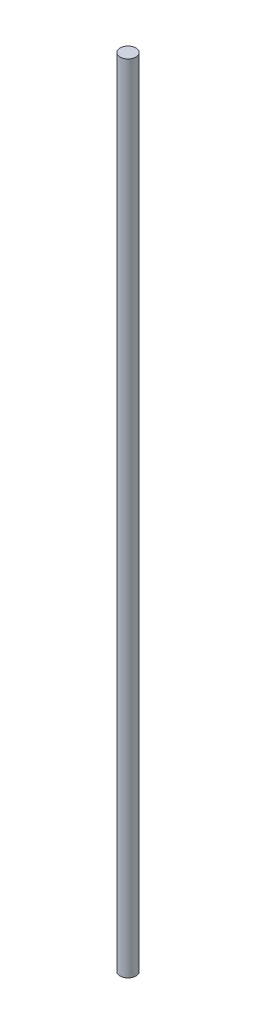
from build123d import *

# Parameters (mm, degrees)
CROQUIS1_R              = 2.5
SALIENTE_EXTRUIR1_DEPTH = 250


with BuildPart() as part:
    # Croquis1 → Saliente-Extruir1 (new body)
    with BuildSketch(Plane(origin=(0, 0, 0), x_dir=(1, 0, 0), z_dir=(0, 1, 0))):
        with Locations(Location((0, 0, 0), (0, 0, 270))):
            Circle(CROQUIS1_R)
    extrude(amount=SALIENTE_EXTRUIR1_DEPTH)


solid = part.part
